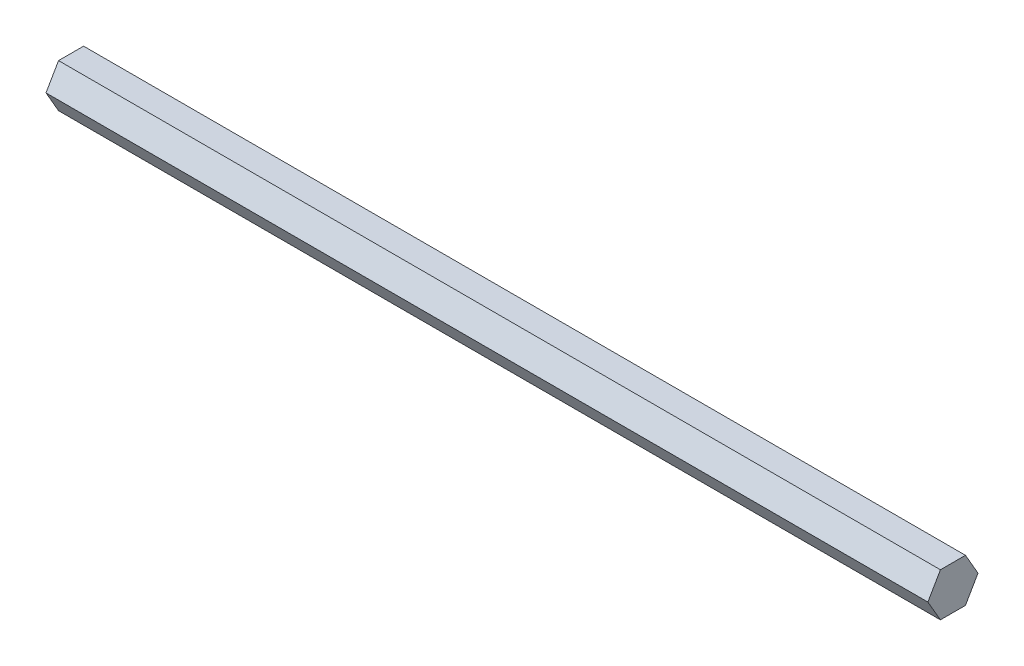
from build123d import *

# Parameters (mm, degrees)
BOSS_EXTRUDE1_DEPTH = 101.6


with BuildPart() as part:
    # Sketch1 → Boss-Extrude1 (new body)
    with BuildSketch(Plane(origin=(0, 0, 0), x_dir=(0, 0, -1), z_dir=(1, 0, 0))):
        Polygon((1.443375673, 2.5), (-1.443375673, 2.5), (-2.886751346, 0), (-1.443375673, -2.5), (1.443375673, -2.5), (2.886751346, 0), align=None)
    extrude(amount=BOSS_EXTRUDE1_DEPTH)


solid = part.part
